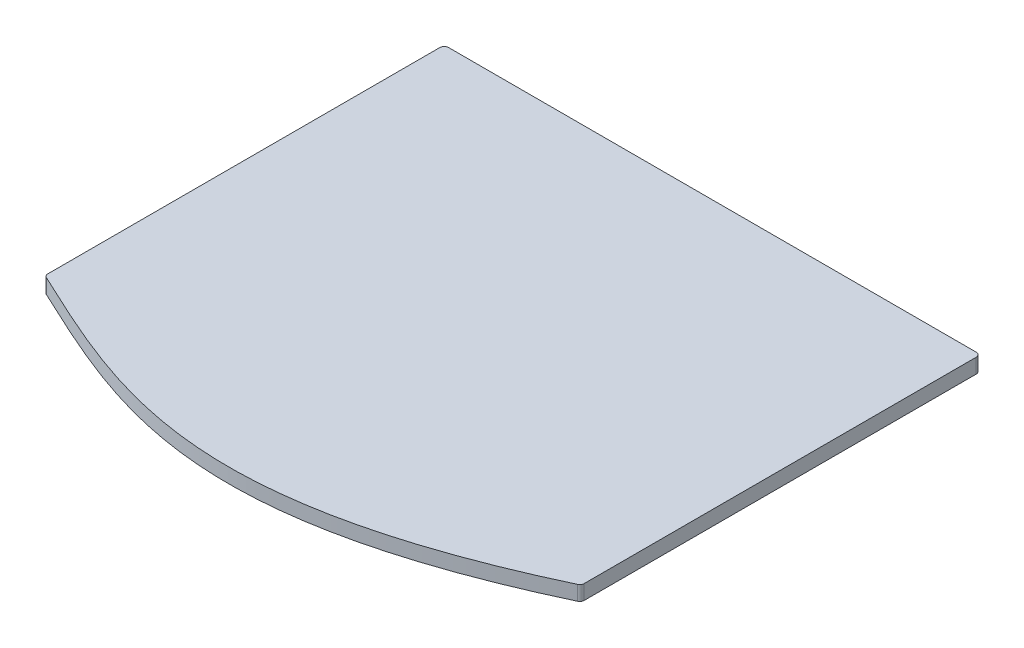
from build123d import *

# Parameters (mm, degrees)
BOSS_EXTRUDE1_DEPTH = 10


with BuildPart() as part:
    # Sketch1 → Boss-Extrude1 (new body)
    with BuildSketch(Plane(origin=(0, 0, 0), x_dir=(1, 0, 0), z_dir=(0, 1, 0))):
        with BuildLine():
            Line((-183, 130), (-183, -137.480797285))
            ThreePointArc((-183, -137.480797285), (-182.533478711, -139.087497512), (-181.279009588, -140.194491165))
            add(Edge.make_bspline(
                [(-181.279009588, -140.194491165), (-178.340737073, -141.579348442), (-172.453888435, -144.353901137), (-160.745962638, -149.828936181), (-146.131511082, -156.50262626), (-128.508260207, -164.046283741), (-104.70271928, -173.254127298), (-74.01695968, -182.744139439), (-41.044371476, -188.463963896), (-12.576810854, -190.101586868), (10.006230222, -189.672423751), (34.003753798, -187.388029591), (59.589491457, -183.03969182), (82.369462797, -177.517534008), (101.543699637, -171.852795873), (116.417253833, -166.953916141), (131.801190076, -161.377995825), (145.060365154, -156.145247632), (155.940082719, -151.594001252), (164.236790758, -147.995411699), (171.271002297, -144.837475157), (176.961457618, -142.218806841), (179.845058415, -140.870336481), (181.279009588, -140.194491165)],
                knots=[0, 0, 0, 0, 0.03125, 0.0625, 0.125, 0.1875, 0.25, 0.375, 0.5, 0.5625, 0.625, 0.6875, 0.75, 0.8125, 0.84375, 0.875, 0.90625, 0.9375, 0.953125, 0.96875, 0.984375, 0.9921875, 1, 1, 1, 1], degree=3))
            ThreePointArc((181.279009588, -140.194491165), (182.533478711, -139.087497512), (183, -137.480797285))
            Line((183, -137.480797285), (183, 130))
            ThreePointArc((183, 130), (182.121320344, 132.121320344), (180, 133))
            Line((180, 133), (-180, 133))
            ThreePointArc((-180, 133), (-182.121320344, 132.121320344), (-183, 130))
        make_face()
    extrude(amount=BOSS_EXTRUDE1_DEPTH)


solid = part.part
